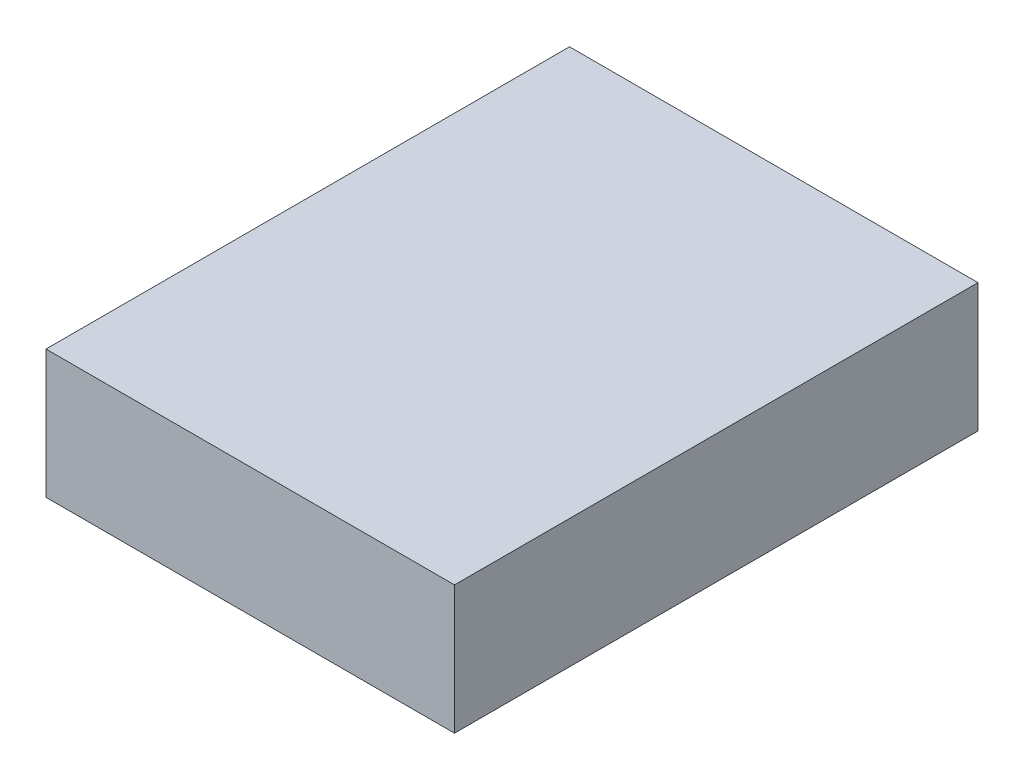
from build123d import *

# Parameters (mm, degrees)
SKETCH1_W           = 63.6
SKETCH1_H           = 81.5
BOSS_EXTRUDE1_DEPTH = 20


with BuildPart() as part:
    # Sketch1 → Boss-Extrude1 (new body)
    with BuildSketch(Plane(origin=(0, 0, 0), x_dir=(1, 0, 0), z_dir=(0, 1, 0))):
        Rectangle(SKETCH1_W, SKETCH1_H)
    extrude(amount=BOSS_EXTRUDE1_DEPTH)


solid = part.part
